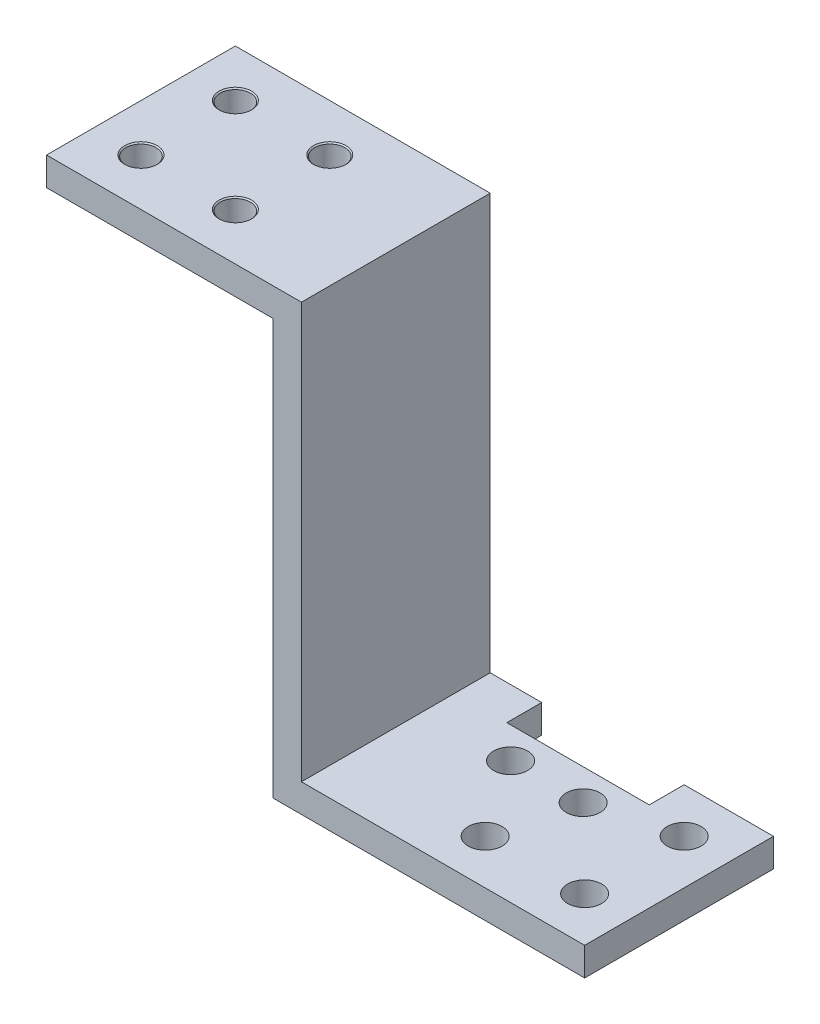
from build123d import *

# Parameters (mm, degrees)
BOSS_EXTRUDE1_DEPTH            = 20
M3_CLEARANCE_HOLE1_D           = 3.2
M3_CLEARANCE_HOLE1_CSINK_D     = 3.45
M3_CLEARANCE_HOLE1_CSINK_ANGLE = 90
SKETCH4_W                      = 15.088998531
SKETCH4_H                      = 3.695589791
CUT_EXTRUDE1_DEPTH             = 75.732857566
M3_CLEARANCE_HOLE2_D           = 3.6
M3_CLEARANCE_HOLE3_D           = 3.6


with BuildPart() as part:
    # Sketch1 → Boss-Extrude1 (new body)
    with BuildSketch(Plane.XY):
        Polygon((0, 44), (24, 44), (24, 0), (57, 0), (57, 3), (27, 3), (27, 47), (0, 47), align=None)
    extrude(amount=BOSS_EXTRUDE1_DEPTH)

    # M3 Clearance Hole1 (through all)
    with Locations(Plane(origin=(0, 47, 0), x_dir=(1, 0, 0), z_dir=(0, 1, 0))):
        with Locations((15, -15), (5, -5), (5, -15), (15, -5)):
            CounterSinkHole(M3_CLEARANCE_HOLE1_D / 2, M3_CLEARANCE_HOLE1_CSINK_D / 2, counter_sink_angle=M3_CLEARANCE_HOLE1_CSINK_ANGLE)

    # Sketch4 → Cut-Extrude1 (cut, through all)
    with BuildSketch(Plane(origin=(0, 3, 0), x_dir=(1, 0, 0), z_dir=(0, 1, 0))):
        with Locations((39.995300814, -1.847794896)):
            Rectangle(SKETCH4_W, SKETCH4_H)
    extrude(amount=-CUT_EXTRUDE1_DEPTH, mode=Mode.SUBTRACT)

    # M3 Clearance Hole2 (through all)
    with Locations(Plane(origin=(0, 3, 0), x_dir=(1, 0, 0), z_dir=(0, 1, 0))):
        with Locations((36.150801548, -6.995589791), (43.839800079, -6.995589791)):
            Hole(M3_CLEARANCE_HOLE2_D / 2)

    # M3 Clearance Hole3 (through all)
    with Locations(Plane(origin=(0, 3, 0), x_dir=(1, 0, 0), z_dir=(0, 1, 0))):
        with Locations((41.730099961, -15.269900039), (52.269900039, -15.269900039), (52.269900039, -4.730099961)):
            Hole(M3_CLEARANCE_HOLE3_D / 2)


solid = part.part
